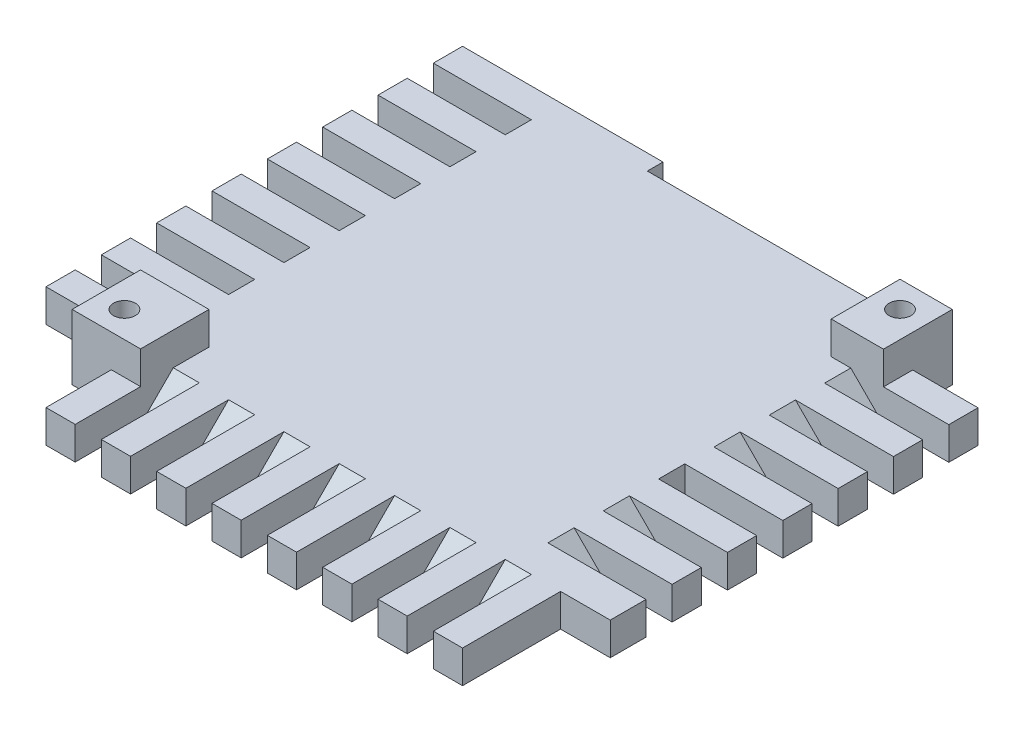
from build123d import *
from build123d.topology import SkipClean

# Parameters (mm, degrees)
BASE_OUTLINE_R      = 0.5
BOSS_EXTRUDE1_DEPTH = 1.5
DRAFT2_ANGLE        = 45
BOSS_EXTRUDE2_DEPTH = 1.5
SKETCH1_3_R         = 0.5
CUT_EXTRUDE1_DEPTH  = 5.5


with BuildPart() as part:
    # Base outline → Boss-Extrude1 (new body)
    with BuildSketch(Plane(origin=(0, 0, 0), x_dir=(1, 0, 0), z_dir=(0, 1, 0))):
        Polygon((20.2, 20.2), (6.201628494, 20.2), (6.201628494, 20.92), (-3, 20.92), (-3, 19.58), (0, 19.58), (1.5, 19.58), (1.5, 18.38), (0, 18.38), (-3, 18.38), (-3, 17.04), (0, 17.04), (1.5, 17.04), (1.5, 15.84), (0, 15.84), (-3, 15.84), (-3, 14.5), (0, 14.5), (1.5, 14.5), (1.5, 13.3), (0, 13.3), (-3, 13.3), (-3, 11.96), (0, 11.96), (1.5, 11.96), (1.5, 10.76), (0, 10.76), (-3, 10.76), (-3, 9.42), (0, 9.42), (1.5, 9.42), (1.5, 8.22), (0, 8.22), (-3, 8.22), (-3, 6.88), (0, 6.88), (1.5, 6.88), (1.5, 5.68), (0, 5.68), (-3, 5.68), (-3, 4.34), (0, 4.34), (1.5, 4.34), (1.5, 3.14), (0, 3.14), (-3, 3.14), (-3, 1.8), (0, 1.8), (0, 0), (1.8, 0), (1.8, -3), (3.14, -3), (3.14, 0), (3.14, 1.5), (4.34, 1.5), (4.34, 0), (4.34, -3), (5.68, -3), (5.68, 0), (5.68, 1.5), (6.88, 1.5), (6.88, 0), (6.88, -3), (8.22, -3), (8.22, 0), (8.22, 1.5), (9.42, 1.5), (9.42, 0), (9.42, -3), (10.76, -3), (10.76, 0), (10.76, 1.5), (11.96, 1.5), (11.96, 0), (11.96, -3), (13.3, -3), (13.3, 0), (13.3, 1.5), (14.5, 1.5), (14.5, 0), (14.5, -3), (15.84, -3), (15.84, 0), (15.84, 1.5), (17.04, 1.5), (17.04, 0), (17.04, -3), (18.38, -3), (18.38, 0), (18.38, 1.5), (19.58, 1.5), (19.58, 0), (19.58, -3), (20.92, -3), (20.92, 1.5), (23.2, 1.5), (23.2, 3.14), (20.2, 3.14), (18.7, 3.14), (18.7, 4.34), (20.2, 4.34), (23.2, 4.34), (23.2, 5.68), (20.2, 5.68), (18.7, 5.68), (18.7, 6.88), (20.2, 6.88), (23.2, 6.88), (23.2, 8.22), (20.2, 8.22), (18.7, 8.22), (18.7, 9.42), (20.2, 9.42), (23.2, 9.42), (23.2, 10.76), (20.2, 10.76), (18.7, 10.76), (18.7, 11.96), (20.2, 11.96), (23.2, 11.96), (23.2, 13.3), (20.2, 13.3), (18.7, 13.3), (18.7, 14.5), (20.2, 14.5), (23.2, 14.5), (23.2, 15.84), (20.2, 15.84), (18.7, 15.84), (18.7, 17.04), (20.2, 17.04), (23.2, 17.04), (23.2, 18.38), (20.2, 18.38), (20.2, 19.58), align=None)
        with Locations((1.2, 1.2)):
            Circle(BASE_OUTLINE_R, mode=Mode.SUBTRACT)
        with BuildLine():
            ThreePointArc((18.7, 18.6), (18.5, 19), (18.7, 19.4))
            ThreePointArc((18.7, 19.4), (19.223606798, 19.447213595), (19.5, 19))
            ThreePointArc((19.5, 19), (19.223606798, 18.552786405), (18.7, 18.6))
        make_face(mode=Mode.SUBTRACT)
    extrude(amount=BOSS_EXTRUDE1_DEPTH)

    # Draft2
    draft2_faces = [part.faces().sort_by_distance(p)[0] for p in [
        (1.5, 0.75, -18.98),
        (1.5, 0.75, -16.44),
        (1.5, 0.75, -13.9),
        (1.5, 0.75, -11.36),
        (1.5, 0.75, -8.82),
        (1.5, 0.75, -6.28),
        (1.5, 0.75, -3.74),
        (18.7, 0.75, -16.44),
        (18.7, 0.75, -13.9),
        (18.7, 0.75, -11.36),
        (18.7, 0.75, -6.28),
        (18.7, 0.75, -3.74),
        (18.98, 0.75, -1.5),
        (16.44, 0.75, -1.5),
        (13.9, 0.75, -1.5),
        (11.36, 0.75, -1.5),
        (8.82, 0.75, -1.5),
        (6.28, 0.75, -1.5),
        (3.74, 0.75, -1.5),
    ]]
    draft(draft2_faces, Plane.ZX.offset(1.5), DRAFT2_ANGLE)

    # Spacer outline → Boss-Extrude2 (add)
    with BuildSketch(Plane(origin=(0, 1.5, 0), x_dir=(1, 0, 0), z_dir=(0, 1, 0))):
        Polygon((0, 1.8), (0, 3.14), (1.5, 3.14), (3.14, 3.14), (3.14, 1.5), (3.14, 0), (1.8, 0), (0, 0), align=None)
        Polygon((18.7, 17.04), (17.8, 17.04), (17.8, 20.2), (20.2, 20.2), (20.2, 18.38), (20.2, 17.04), align=None)
    extrude(amount=BOSS_EXTRUDE2_DEPTH)

    # Sketch1<3> → Cut-Extrude1 (cut)
    with SkipClean():  # the faces are left unmerged after this step: merging them gives an invalid solid
        with BuildSketch(Plane(origin=(0, 0, 0), x_dir=(1, 0, 0), z_dir=(0, 1, 0))):
            with Locations((1.2, 1.2)):
                Circle(SKETCH1_3_R)
            with Locations((19, 19)):
                Circle(SKETCH1_3_R)
        extrude(amount=CUT_EXTRUDE1_DEPTH, mode=Mode.SUBTRACT)


solid = part.part
